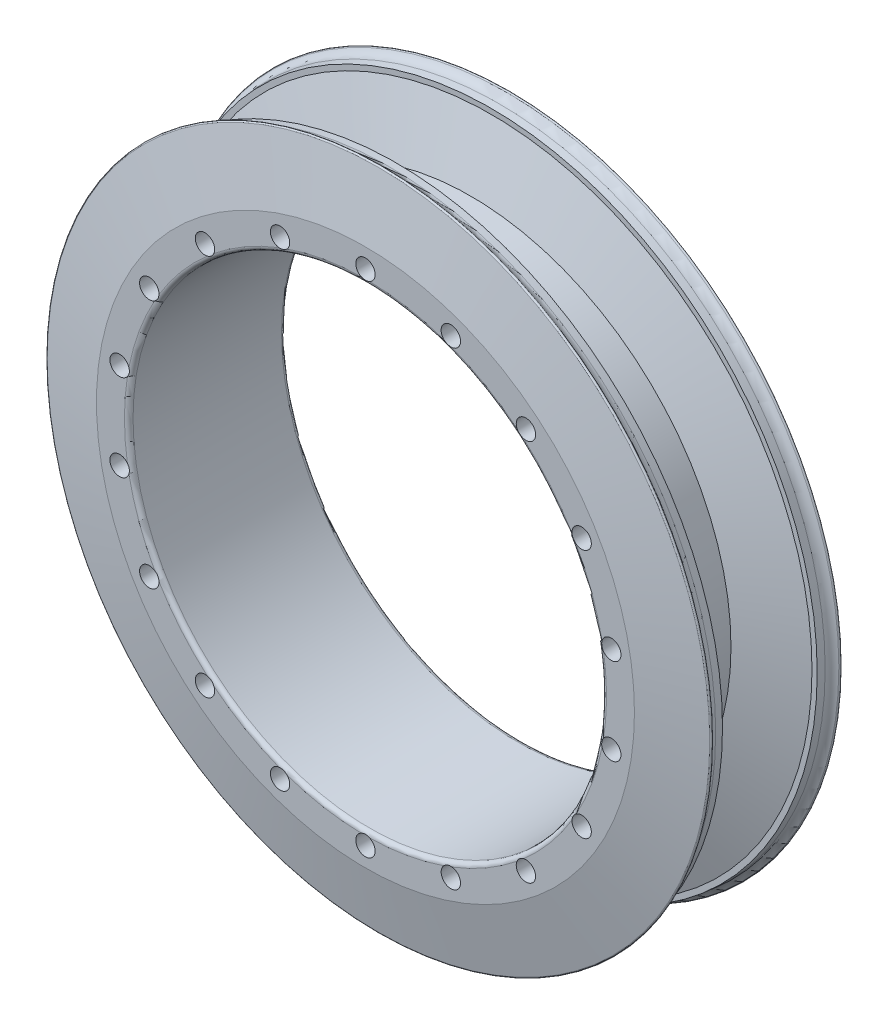
from build123d import *

# Parameters (mm, degrees)
CORTAR_EXTRUIR1_START = -6.18
CROQUIS3_R            = 2.25
CORTAR_EXTRUIR1_DEPTH = 293.591987647
CORTAR_EXTRUIR2_START = 6.18
CROQUIS4_R            = 2.25
CORTAR_EXTRUIR2_DEPTH = 293.591987653


with BuildPart() as part:
    # Croquis2 → Revolución2 (revolve)
    with BuildSketch(Plane(origin=(0, 0, 0), x_dir=(0, 0, -1), z_dir=(1, 0, 0)), mode=Mode.PRIVATE) as revoluci_n2_sk:
        with BuildLine():
            Line((-17.25, 253), (17.25, 253))
            ThreePointArc((17.25, 253), (17.957106781, 253.292893219), (18.25, 254))
            Line((18.25, 254), (18.25, 260.5))
            Line((18.25, 260.5), (15.227019128, 274.966873141))
            ThreePointArc((15.227019128, 274.966873141), (14.982692165, 275.201427222), (14.675490119, 275.058815213))
            ThreePointArc((14.675490119, 275.058815213), (13.845196603, 274.212393697), (12.718301276, 273.843715483))
            Line((12.718301276, 273.843715483), (11, 273.711538462))
            Line((11, 273.711538462), (11, 272.5))
            Line((11, 272.5), (6.179413414, 258.5))
            Line((6.179413414, 258.5), (-6.179413414, 258.5))
            Line((-6.179413414, 258.5), (-11, 272.5))
            Line((-11, 272.5), (-11, 273.711538462))
            Line((-11, 273.711538462), (-12.718301276, 273.843715483))
            ThreePointArc((-12.718301276, 273.843715483), (-13.845196603, 274.212393697), (-14.675490119, 275.058815213))
            ThreePointArc((-14.675490119, 275.058815213), (-14.982692165, 275.201427222), (-15.227019128, 274.966873141))
            Line((-15.227019128, 274.966873141), (-18.25, 260.5))
            Line((-18.25, 260.5), (-18.25, 254))
            ThreePointArc((-18.25, 254), (-17.957106781, 253.292893219), (-17.25, 253))
        make_face()
    revolve(revoluci_n2_sk.sketch.rotate(Axis((0, 198, 23.25), (0, 0, -1)), 90), axis=Axis((0, 198, 23.25), (0, 0, -1)))

    # Croquis3 → Cortar-Extruir1 (cut, through all)
    with BuildSketch(Plane.XY.offset(CORTAR_EXTRUIR1_START)):
        with Locations(Location((0, 256, 0), (0, 0, 243.24755936))):
            Circle(CROQUIS3_R)
        with Locations(Location((19.837168313, 252.502172006, 0), (0, 0, 223.247559503))):
            Circle(CROQUIS3_R)
        with Locations(Location((37.281681362, 242.430577701, 0), (0, 0, 203.247559503))):
            Circle(CROQUIS3_R)
        with Locations(Location((50.229473419, 227, 0), (0, 0, 183.247559503))):
            Circle(CROQUIS3_R)
        with Locations(Location((57.118849675, 208.071594305, 0), (0, 0, 163.247559503))):
            Circle(CROQUIS3_R)
        with Locations(Location((57.118849675, 187.928405695, 0), (0, 0, 196.752440583))):
            Circle(CROQUIS3_R)
        with Locations(Location((50.229473419, 169, 0), (0, 0, 176.752440583))):
            Circle(CROQUIS3_R)
        with Locations(Location((37.281681362, 153.569422299, 0), (0, 0, 156.752440583))):
            Circle(CROQUIS3_R)
        with Locations(Location((19.837168313, 143.497827994, 0), (0, 0, 136.752440583))):
            Circle(CROQUIS3_R)
        with Locations(Location((0, 140, 0), (0, 0, 116.752440583))):
            Circle(CROQUIS3_R)
        with Locations(Location((-19.837168313, 143.497827994, 0), (0, 0, 96.752440583))):
            Circle(CROQUIS3_R)
        with Locations(Location((-37.281681362, 153.569422299, 0), (0, 0, 76.752440583))):
            Circle(CROQUIS3_R)
        with Locations(Location((-50.229473419, 169, 0), (0, 0, 56.752440583))):
            Circle(CROQUIS3_R)
        with Locations(Location((-57.118849675, 187.928405695, 0), (0, 0, 36.752440583))):
            Circle(CROQUIS3_R)
        with Locations(Location((-57.118849675, 208.071594305, 0), (0, 0, 323.24755942))):
            Circle(CROQUIS3_R)
        with Locations(Location((-50.229473419, 227, 0), (0, 0, 303.247559503))):
            Circle(CROQUIS3_R)
        with Locations(Location((-37.281681362, 242.430577701, 0), (0, 0, 283.247559503))):
            Circle(CROQUIS3_R)
        with Locations(Location((-19.837168313, 252.502172006, 0), (0, 0, 263.247559503))):
            Circle(CROQUIS3_R)
    extrude(amount=CORTAR_EXTRUIR1_DEPTH, mode=Mode.SUBTRACT)

    # Croquis4 → Cortar-Extruir2 (cut, through all)
    with BuildSketch(Plane.XY.offset(CORTAR_EXTRUIR2_START)):
        with Locations((10.071594305, 255.118849675)):
            Circle(CROQUIS4_R)
        with Locations((29, 248.229473419)):
            Circle(CROQUIS4_R)
        with Locations((44.430577701, 235.281681362)):
            Circle(CROQUIS4_R)
        with Locations((54.502172006, 217.837168313)):
            Circle(CROQUIS4_R)
        with Locations((58, 198)):
            Circle(CROQUIS4_R)
        with Locations((54.502172006, 178.162831687)):
            Circle(CROQUIS4_R)
        with Locations((44.430577701, 160.718318638)):
            Circle(CROQUIS4_R)
        with Locations((29, 147.770526581)):
            Circle(CROQUIS4_R)
        with Locations((10.071594305, 140.881150325)):
            Circle(CROQUIS4_R)
        with Locations((-10.071594305, 140.881150325)):
            Circle(CROQUIS4_R)
        with Locations((-29, 147.770526581)):
            Circle(CROQUIS4_R)
        with Locations((-44.430577701, 160.718318638)):
            Circle(CROQUIS4_R)
        with Locations((-54.502172006, 178.162831687)):
            Circle(CROQUIS4_R)
        with Locations((-58, 198)):
            Circle(CROQUIS4_R)
        with Locations((-54.502172006, 217.837168313)):
            Circle(CROQUIS4_R)
        with Locations((-44.430577701, 235.281681362)):
            Circle(CROQUIS4_R)
        with Locations((-29, 248.229473419)):
            Circle(CROQUIS4_R)
        with Locations((-10.071594305, 255.118849675)):
            Circle(CROQUIS4_R)
    extrude(amount=-CORTAR_EXTRUIR2_DEPTH, mode=Mode.SUBTRACT)


solid = part.part
